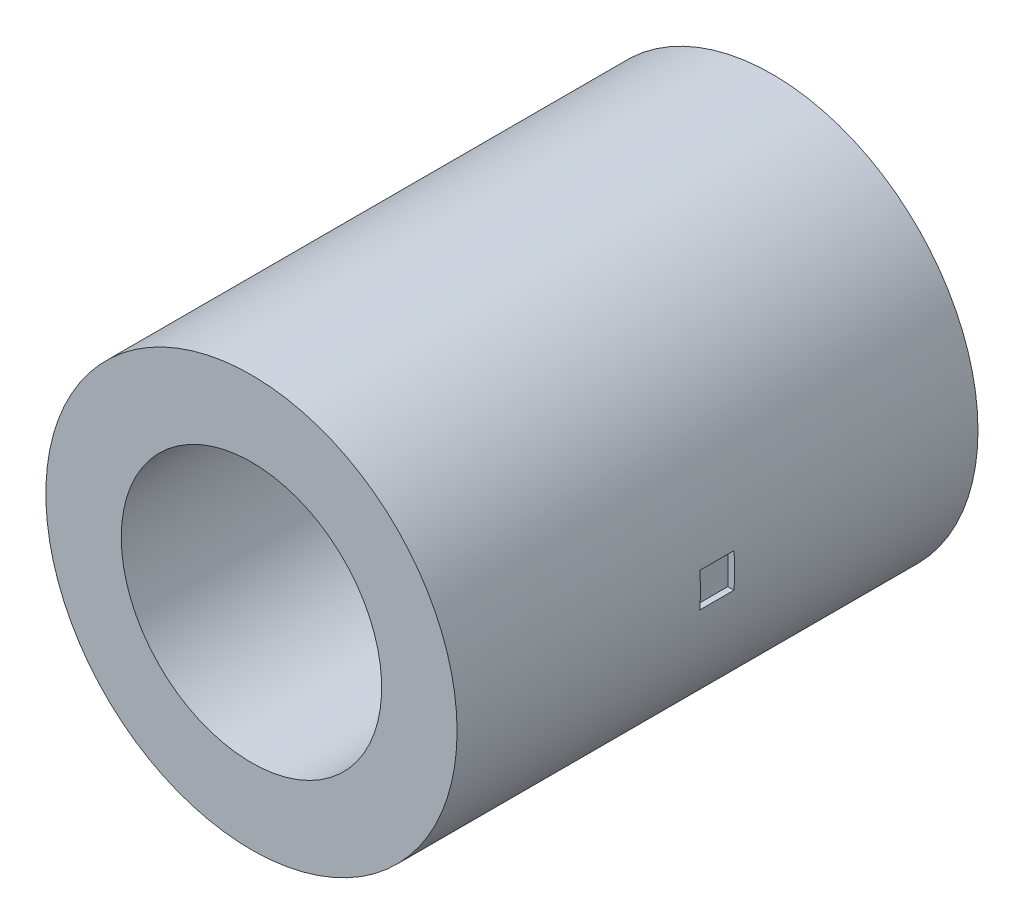
from build123d import *

# Parameters (mm, degrees)
CROQUIS1_R              = 3
CROQUIS1_R_2            = 1.9
SALIENTE_EXTRUIR1_DEPTH = 7.6
CROQUIS3_W              = 0.5
CROQUIS3_H              = 0.5
CORTAR_EXTRUIR1_DEPTH   = 0.1


with BuildPart() as part:
    # Croquis1 → Saliente-Extruir1 (new body)
    with BuildSketch(Plane.XY):
        with Locations(Location((0, 0, 0), (0, 0, 180))):
            Circle(CROQUIS1_R)
        with Locations(Location((0, 0, 0), (0, 0, 180))):
            Circle(CROQUIS1_R_2, mode=Mode.SUBTRACT)
    extrude(amount=SALIENTE_EXTRUIR1_DEPTH)

    # Croquis3 → Cortar-Extruir1 (cut)
    with BuildSketch(Plane.ZY.offset(3)):
        with Locations((3.8, 0)):
            Rectangle(CROQUIS3_W, CROQUIS3_H)
    cortar_extruir1 = extrude(amount=-CORTAR_EXTRUIR1_DEPTH, mode=Mode.SUBTRACT)

    # Simetría1: Cortar-Extruir1 across plane
    add(cortar_extruir1.mirror(Plane(origin=(0, 0, 0), x_dir=(0, 0, 1), z_dir=(1, 0, 0))), mode=Mode.SUBTRACT)


solid = part.part
